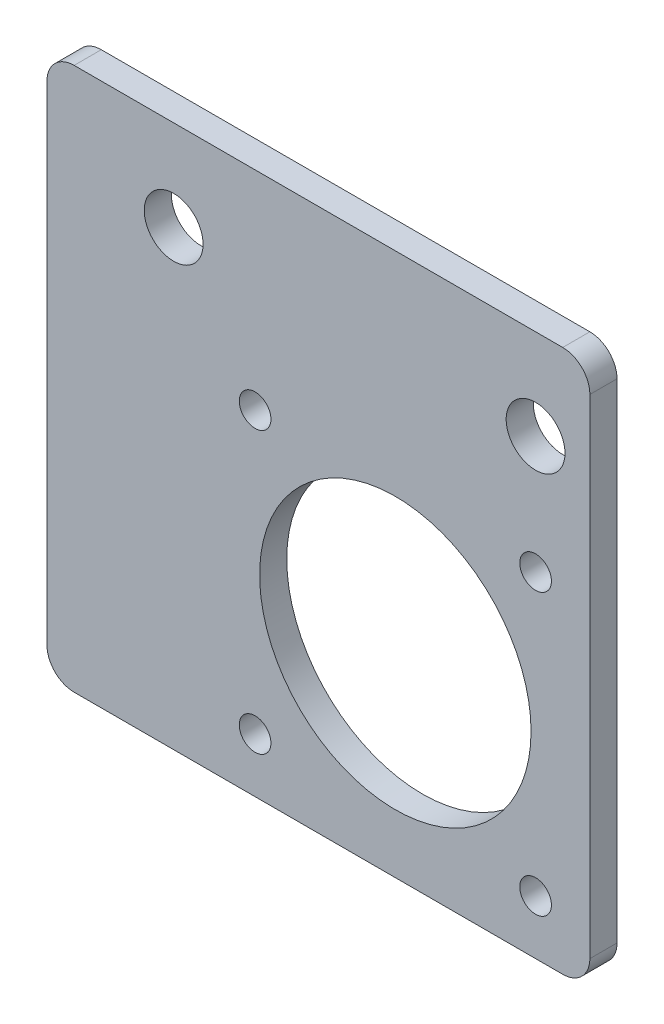
from build123d import *

# Parameters (mm, degrees)
SKIZZE1_W                       = 60
SKIZZE1_H                       = 60
AUFSATZ_LINEAR_AUSTRAGEN1_DEPTH = 3
VERRUNDUNG1_R                   = 3
SKIZZE2_R                       = 1.75
SKIZZE2_R_2                     = 3.25
SKIZZE2_R_3                     = 15
SCHNITT_LINEAR_AUSTRAGEN1_DEPTH = 12


with BuildPart() as part:
    # Skizze1 → Aufsatz-Linear austragen1 (new body)
    with BuildSketch(Plane.XY):
        Rectangle(SKIZZE1_W, SKIZZE1_H)
    extrude(amount=AUFSATZ_LINEAR_AUSTRAGEN1_DEPTH)

    # Verrundung1
    verrundung1_edges = [part.edges().sort_by_distance(p)[0] for p in [
        (-30, 30, 1.5),
        (30, 30, 1.5),
        (30, -30, 1.5),
        (-30, -30, 1.5),
    ]]
    fillet(verrundung1_edges, radius=VERRUNDUNG1_R)

    # Skizze2 → Schnitt-Linear austragen1 (cut)
    with BuildSketch(Plane.XY.offset(3)):
        with Locations((-7, -24)):
            Circle(SKIZZE2_R)
        with Locations((-7, 7)):
            Circle(SKIZZE2_R)
        with Locations((24, 7)):
            Circle(SKIZZE2_R)
        with Locations((24, -24)):
            Circle(SKIZZE2_R)
        with Locations((24, 20)):
            Circle(SKIZZE2_R_2)
        with Locations((-16, 20)):
            Circle(SKIZZE2_R_2)
        with Locations((8.5, -8.5)):
            Circle(SKIZZE2_R_3)
    extrude(amount=-SCHNITT_LINEAR_AUSTRAGEN1_DEPTH, mode=Mode.SUBTRACT)


solid = part.part
